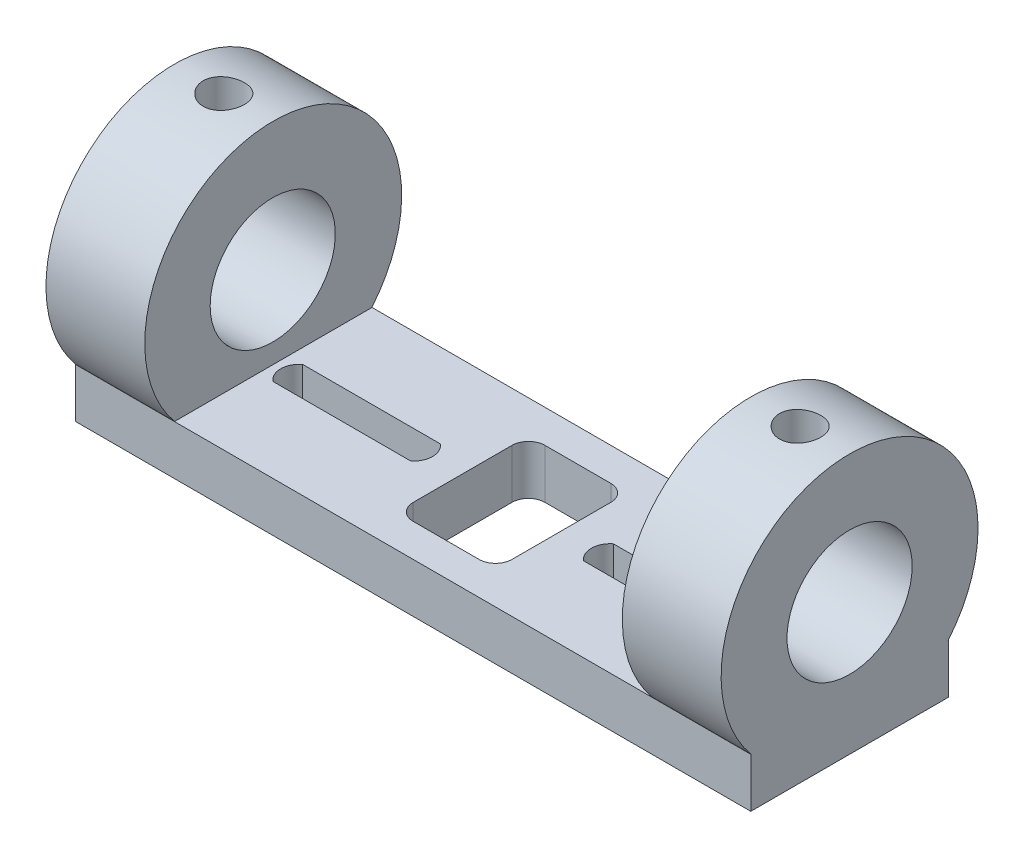
from build123d import *

# Parameters (mm, degrees)
SKETCH_1_W           = 41
SKETCH_1_H           = 12
EXTRUDE_1_DEPTH      = 3
EXTRUDE_2_DEPTH      = 2.5
EXTRUDE_2_DEPTH_BACK = 3.5
SKETCH_2_R           = 7.8
SKETCH_2_R_2         = 3.8
SKETCH_4_R           = 7.8
SKETCH_4_R_2         = 3.8
EXTRUDE_3_DEPTH      = 6
SKETCH_7_R           = 1.25
CUT_EXTRUDE_1_DEPTH  = 16


with BuildPart() as part:
    # 草图1 → 凸台-拉伸1 (new body)
    with BuildSketch(Plane(origin=(0, 0, 0), x_dir=(1, 0, 0), z_dir=(0, 1, 0))):
        Rectangle(SKETCH_1_W, SKETCH_1_H)
        with BuildLine():
            ThreePointArc((13.615779121, 0.9), (14.049888068, 0), (13.615779121, -0.9))
            Line((13.615779121, -0.9), (5.254817408, -0.9))
            ThreePointArc((5.254817408, -0.9), (4.820708461, 0), (5.254817408, 0.9))
            Line((5.254817408, 0.9), (13.615779121, 0.9))
        make_face(mode=Mode.SUBTRACT)
        with BuildLine():
            Line((2, -4), (-2, -4))
            ThreePointArc((-2, -4), (-2.707106781, -3.707106781), (-3, -3))
            Line((-3, -3), (-3, 3))
            ThreePointArc((-3, 3), (-2.707106781, 3.707106781), (-2, 4))
            Line((-2, 4), (2, 4))
            ThreePointArc((2, 4), (2.707106781, 3.707106781), (3, 3))
            Line((3, 3), (3, -3))
            ThreePointArc((3, -3), (2.707106781, -3.707106781), (2, -4))
        make_face(mode=Mode.SUBTRACT)
        with BuildLine():
            Line((-13.615779121, 0.9), (-5.254817408, 0.9))
            ThreePointArc((-5.254817408, 0.9), (-4.820708461, 0), (-5.254817408, -0.9))
            Line((-5.254817408, -0.9), (-13.615779121, -0.9))
            ThreePointArc((-13.615779121, -0.9), (-14.049888068, 0), (-13.615779121, 0.9))
        make_face(mode=Mode.SUBTRACT)
    extrude(amount=EXTRUDE_1_DEPTH)

    # 草图2 → 凸台-拉伸2 (add, two sides: drawn at the far end of the back side and taken through both)
    with BuildSketch(Plane.ZY.offset(18).offset(-EXTRUDE_2_DEPTH_BACK)):
        with Locations((0, 8)):
            Circle(SKETCH_2_R)
        with Locations((0.029069435, 7.993834456)):
            Circle(SKETCH_2_R_2, mode=Mode.SUBTRACT)
    extrude(amount=EXTRUDE_2_DEPTH + EXTRUDE_2_DEPTH_BACK)

    # 草图4 → 凸台-拉伸3 (add)
    with BuildSketch(Plane(origin=(20.5, 0, 0), x_dir=(0, 0, -1), z_dir=(1, 0, 0))):
        with Locations((0, 8)):
            Circle(SKETCH_4_R)
        with Locations((0, 8)):
            Circle(SKETCH_4_R_2, mode=Mode.SUBTRACT)
    extrude(amount=-EXTRUDE_3_DEPTH)

    # 草图7 → 切除-拉伸1 (cut)
    with BuildSketch(Plane(origin=(0, 7.993834456, 0), x_dir=(1, 0, 0), z_dir=(0, 1, 0))):
        with Locations((-17.5, 0)):
            Circle(SKETCH_7_R)
        with Locations((17.5, 0)):
            Circle(SKETCH_7_R)
    extrude(amount=CUT_EXTRUDE_1_DEPTH, mode=Mode.SUBTRACT)


solid = part.part
